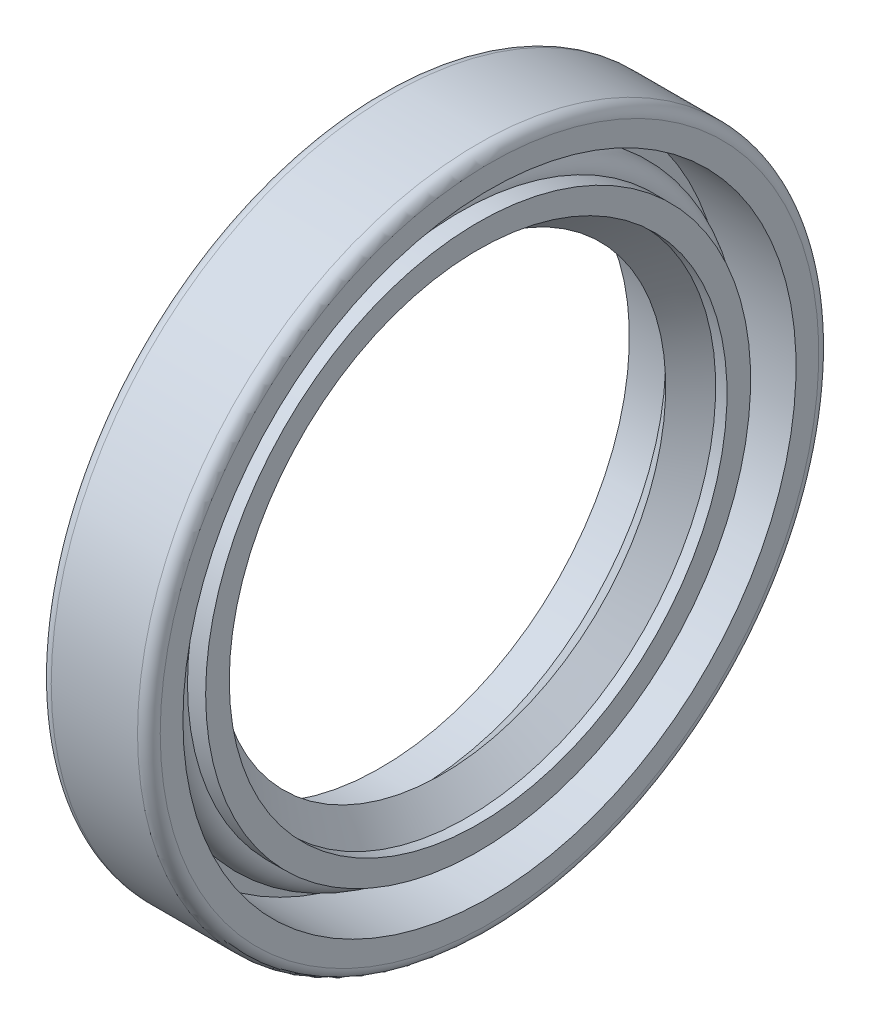
from build123d import *

# Parameters (mm, degrees)
FILLET1_R = 0.635


with BuildPart() as part:
    # Sketch1 → Revolve1 (revolve)
    with BuildSketch(Plane.XY, mode=Mode.PRIVATE) as revolve1_sk:
        with BuildLine():
            Line((-23.425738216, 5.85380266), (-21.393738216, 5.85380266))
            Line((-21.393738216, 5.85380266), (-19.996738216, 4.45680266))
            Line((-19.996738216, 4.45680266), (-18.599738216, 5.85380266))
            Line((-18.599738216, 5.85380266), (-17.964738216, 5.85380266))
            Line((-17.964738216, 5.85380266), (-17.964738216, 7.17460266))
            Line((-17.964738216, 7.17460266), (-18.980738216, 7.17460266))
            ThreePointArc((-18.980738216, 7.17460266), (-19.996738216, 8.19060266), (-21.012738216, 7.17460266))
            Line((-21.012738216, 7.17460266), (-21.393738216, 7.17460266))
            Line((-21.393738216, 7.17460266), (-21.393738216, 9.07960266))
            Line((-21.393738216, 9.07960266), (-17.329738216, 9.07960266))
            Line((-17.329738216, 9.07960266), (-17.329738216, 10.98460266))
            Line((-17.329738216, 10.98460266), (-23.425738216, 10.98460266))
            Line((-23.425738216, 10.98460266), (-23.425738216, 9.07960266))
            Line((-23.425738216, 9.07960266), (-23.425738216, 5.85380266))
        make_face()
    revolve(revolve1_sk.sketch.rotate(Axis((-23.425738216, -8.06539734, 0), (1, 0, 0)), 90), axis=Axis((-23.425738216, -8.06539734, 0), (1, 0, 0)))

    # Fillet1
    fillet1_edges = [part.edges().sort_by_distance(p)[0] for p in [
        (-17.329738216, -8.06539734, -19.05),
        (-23.425738216, -8.06539734, -19.05),
    ]]
    fillet(fillet1_edges, radius=FILLET1_R)


solid = part.part
